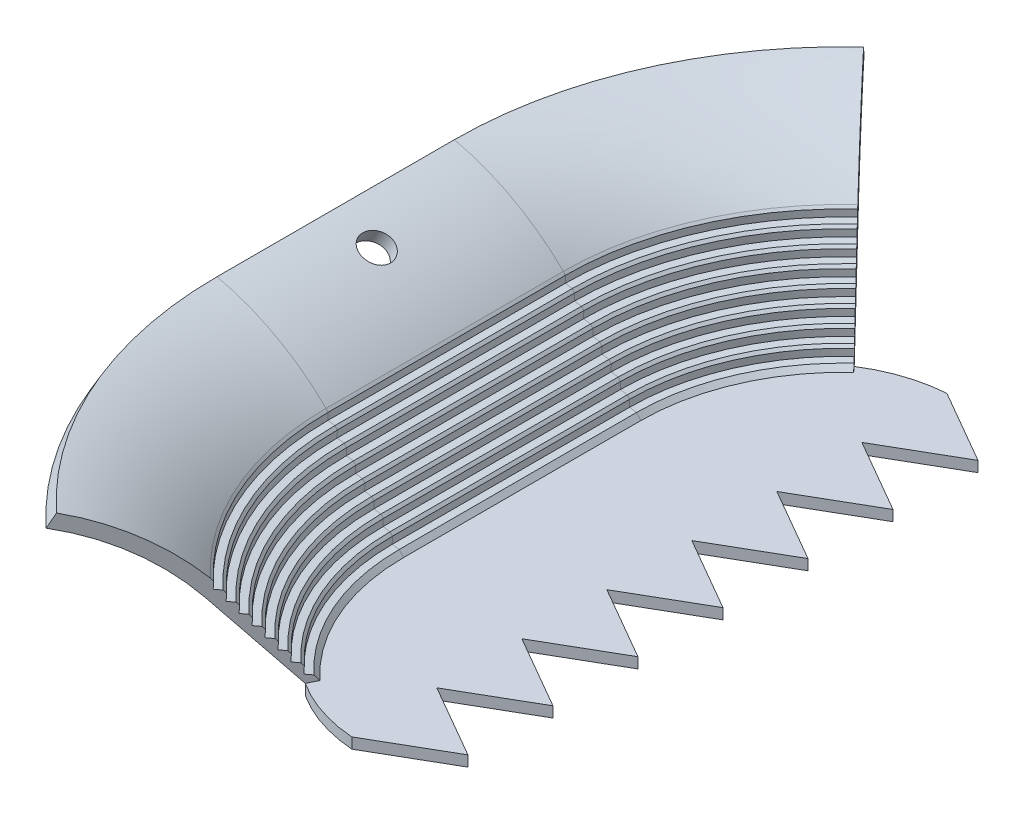
from build123d import *

# Parameters (mm, degrees)
BOSS_EXTRUDE1_DEPTH = 6.665
CUT_EXTRUDE2_DEPTH  = 26.439635203
LPATTERN1_COUNT     = 8
LPATTERN1_PITCH     = 1.33
BOSS_EXTRUDE2_DEPTH = 1
SKETCH12_R          = 1.425
CUT_EXTRUDE4_DEPTH  = 68.19127885


with BuildPart() as part:
    # Sketch1 → Boss-Extrude1 (new, symmetric)
    with BuildSketch(Plane.XY):
        with BuildLine():
            Line((-5.635928665, 7.156958206), (1, 0))
            Line((1, 0), (1.978038604, 0.208423819))
            Line((1.978038604, 0.208423819), (-5.306204433, 8.736958206))
            ThreePointArc((-5.306204433, 8.736958206), (-10.044936575, 12.250309514), (-15.564524684, 14.33198356))
            Line((-15.564524684, 14.33198356), (-16.250550344, 13.11))
            ThreePointArc((-16.250550344, 13.11), (-10.479442469, 10.960456342), (-5.635928665, 7.156958206))
        make_face()
    extrude(amount=BOSS_EXTRUDE1_DEPTH, both=True)

    # Sketch2 → Cut-Extrude2 (cut, symmetric)
    with BuildSketch(Plane.XY.offset(6.665)):
        Polygon((-3.982294286, 46.704559607), (-5.111367134, 8.50883888), (-5.131163815, 7.839131413), (-4.46660252, 7.753935845), (33.435614326, 2.894939498), (91.54886787, 52.52961802), (54.130959258, 96.339238129), align=None)
    cut_extrude2 = extrude(amount=CUT_EXTRUDE2_DEPTH, both=True, mode=Mode.SUBTRACT)

    # LPattern1: Cut-Extrude2 ×8
    with Locations(*[Vector(0.6494576652092012, -0.7603977519042342, 0) * (i * LPATTERN1_PITCH) for i in range(1, LPATTERN1_COUNT)]):
        add(cut_extrude2, mode=Mode.SUBTRACT)

    # Sweep1: sweep along a path in Sketch5
    with BuildLine(Plane(origin=(0, 0, 0), x_dir=(1, 0, 0), z_dir=(0, 1, 0))) as sweep1_path:
        Line((1, -6.665), (1, -11.165))
        ThreePointArc((1, -11.165), (2.66969722, -19.165), (7.4, -25.829242224))
    # Sketch3 → Sweep1 (sweep)
    with BuildSketch(Plane.XY.offset(6.665)):
        with BuildLine():
            Line((-5.111367134, 8.50883888), (-5.306204433, 8.736958206))
            ThreePointArc((-5.306204433, 8.736958206), (-10.044936575, 12.250309514), (-15.564524684, 14.33198356))
            Line((-15.564524684, 14.33198356), (-16.250550344, 13.11))
            ThreePointArc((-16.250550344, 13.11), (-10.479442469, 10.960456342), (-5.635928665, 7.156958206))
            Line((-5.635928665, 7.156958206), (1, 0))
            Line((1, 0), (1.978038604, 0.208423819))
            Line((1.978038604, 0.208423819), (1.579848343, 0.674632774))
            Line((1.579848343, 0.674632774), (0.915287048, 0.759828343))
            Line((0.915287048, 0.759828343), (0.935083729, 1.42953581))
            Line((0.935083729, 1.42953581), (0.716069648, 1.685961784))
            Line((0.716069648, 1.685961784), (0.051508353, 1.771157353))
            Line((0.051508353, 1.771157353), (0.071305034, 2.44086482))
            Line((0.071305034, 2.44086482), (-0.147709047, 2.697290795))
            Line((-0.147709047, 2.697290795), (-0.812270342, 2.782486363))
            Line((-0.812270342, 2.782486363), (-0.79247366, 3.45219383))
            Line((-0.79247366, 3.45219383), (-1.011487741, 3.708619805))
            Line((-1.011487741, 3.708619805), (-1.676049036, 3.793815373))
            Line((-1.676049036, 3.793815373), (-1.656252355, 4.46352284))
            Line((-1.656252355, 4.46352284), (-1.875266436, 4.719948815))
            Line((-1.875266436, 4.719948815), (-2.539827731, 4.805144383))
            Line((-2.539827731, 4.805144383), (-2.52003105, 5.47485185))
            Line((-2.52003105, 5.47485185), (-2.739045131, 5.731277825))
            Line((-2.739045131, 5.731277825), (-3.403606426, 5.816473393))
            Line((-3.403606426, 5.816473393), (-3.383809744, 6.48618086))
            Line((-3.383809744, 6.48618086), (-3.602823825, 6.742606835))
            Line((-3.602823825, 6.742606835), (-4.267385121, 6.827802403))
            Line((-4.267385121, 6.827802403), (-4.247588439, 7.49750987))
            Line((-4.247588439, 7.49750987), (-4.46660252, 7.753935845))
            Line((-4.46660252, 7.753935845), (-5.131163815, 7.839131413))
            Line((-5.131163815, 7.839131413), (-5.111367134, 8.50883888))
        make_face()
    sweep1 = sweep(path=sweep1_path.line)

    # Mirror1: Sweep1 across plane
    add(sweep1.mirror(Plane.XY))

    # Sketch12 → Cut-Extrude4 (cut, through all)
    with BuildSketch(Plane(origin=(-25.092317038, 18.067298753, 6.665), x_dir=(-0.8722573757239733, 0.4890471045769798, 0), z_dir=(-0.4890471045769798, -0.8722573757239733, 0))):
        with Locations(Location((-14.136648815, 6.665, 0), (0, 0, 180))):
            Circle(SKETCH12_R)
    extrude(amount=-CUT_EXTRUDE4_DEPTH, mode=Mode.SUBTRACT)


with BuildPart() as body_2:
    # Sketch9 → Boss-Extrude2 (new body)
    with BuildSketch(Plane(origin=(0, 0, 0), x_dir=(1, 0, 0), z_dir=(0, 1, 0))):
        with BuildLine():
            Line((13.949642027, 20), (20.877845257, 24))
            Line((20.877845257, 24), (13.949642027, 28))
            ThreePointArc((13.949642027, 28), (10.538992417, 27.324445134), (7.4, 25.829242224))
            ThreePointArc((7.4, 25.829242224), (2.66969722, 19.165), (1, 11.165))
            Line((1, 11.165), (1, -11.165))
            ThreePointArc((1, -11.165), (2.66969722, -19.165), (7.4, -25.829242224))
            ThreePointArc((7.4, -25.829242224), (10.538992417, -27.324445134), (13.949642027, -28))
            Line((13.949642027, -28), (20.877845257, -24))
            Line((20.877845257, -24), (13.949642027, -20))
            Line((13.949642027, -20), (20.877845257, -16))
            Line((20.877845257, -16), (13.949642027, -12))
            Line((13.949642027, -12), (20.877845257, -8))
            Line((20.877845257, -8), (13.949642027, -4))
            Line((13.949642027, -4), (20.877845257, 0))
            Line((20.877845257, 0), (13.949642027, 4))
            Line((13.949642027, 4), (20.877845257, 8))
            Line((20.877845257, 8), (13.949642027, 12))
            Line((13.949642027, 12), (20.877845257, 16))
            Line((20.877845257, 16), (13.949642027, 20))
        make_face()
    extrude(amount=-BOSS_EXTRUDE2_DEPTH)


solid = Compound([part.part, body_2.part])
